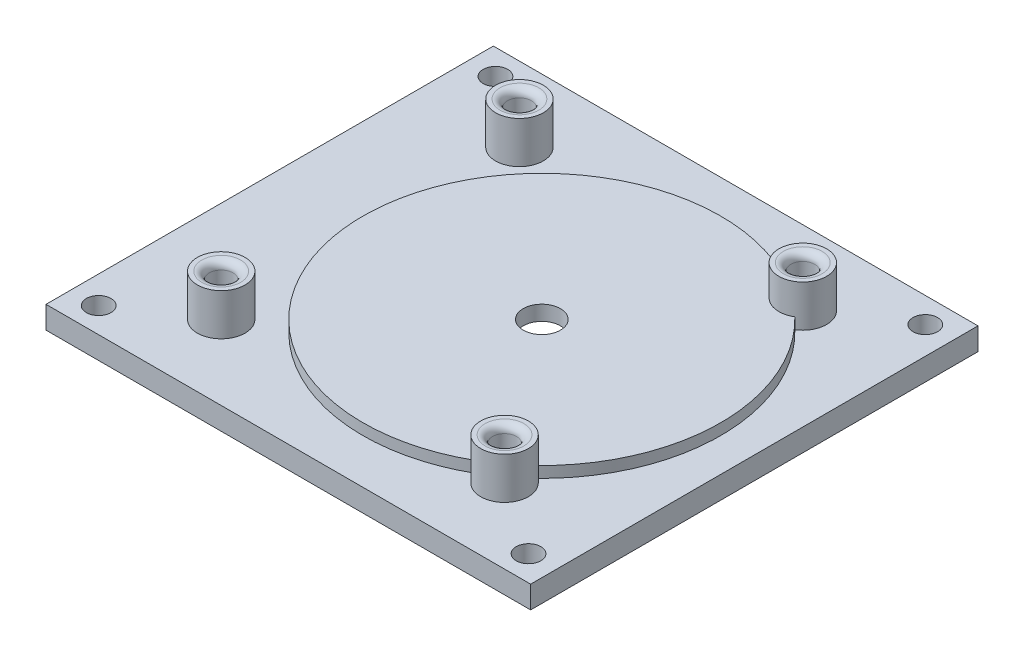
from build123d import *

# Parameters (mm, degrees)
SKETCH2_W           = 65
SKETCH2_H           = 60
SKETCH2_R           = 1.65
BOSS_EXTRUDE1_DEPTH = 3
SKETCH3_R           = 24
BOSS_EXTRUDE2_DEPTH = 1.5
SKETCH5_R           = 19
CUT_EXTRUDE1_DEPTH  = 2.5
SKETCH6_R           = 2.5
CUT_EXTRUDE2_DEPTH  = 89.573415876
SKETCH7_R           = 3.2
SKETCH7_R_2         = 1.6
BOSS_EXTRUDE3_DEPTH = 5.6
FILLET1_R           = 1


with BuildPart() as part:
    # Sketch2 → Boss-Extrude1 (new body)
    with BuildSketch(Plane(origin=(0, 0, 0), x_dir=(1, 0, 0), z_dir=(0, 1, 0))):
        with Locations((32.5, -30)):
            Rectangle(SKETCH2_W, SKETCH2_H)
        with Locations(Location((3.674017223, -3.391400514, 0), (0, 0, 270))):
            Circle(SKETCH2_R, mode=Mode.SUBTRACT)
        with Locations(Location((61.325982777, -3.391400514, 0), (0, 0, 270))):
            Circle(SKETCH2_R, mode=Mode.SUBTRACT)
        with Locations(Location((61.325982777, -56.608599486, 0), (0, 0, 270))):
            Circle(SKETCH2_R, mode=Mode.SUBTRACT)
        with Locations(Location((3.674017223, -56.608599486, 0), (0, 0, 270))):
            Circle(SKETCH2_R, mode=Mode.SUBTRACT)
    extrude(amount=BOSS_EXTRUDE1_DEPTH)

    # Sketch3 → Boss-Extrude2 (add)
    with BuildSketch(Plane(origin=(0, 3, 0), x_dir=(1, 0, 0), z_dir=(0, 1, 0))):
        with Locations(Location((36.5, -30, 0), (0, 0, 270))):
            Circle(SKETCH3_R)
    extrude(amount=BOSS_EXTRUDE2_DEPTH)

    # Sketch5 → Cut-Extrude1 (cut)
    with BuildSketch(Plane(origin=(0, 0, 0), x_dir=(1, 0, 0), z_dir=(0, 1, 0))):
        with Locations(Location((36.5, -30, 0), (0, 0, 270))):
            Circle(SKETCH5_R)
    extrude(amount=CUT_EXTRUDE1_DEPTH, mode=Mode.SUBTRACT)

    # Sketch6 → Cut-Extrude2 (cut, through all)
    with BuildSketch(Plane(origin=(0, 4.5, 0), x_dir=(1, 0, 0), z_dir=(0, 1, 0))):
        with Locations(Location((36.5, -30, 0), (0, 0, 270))):
            Circle(SKETCH6_R)
    extrude(amount=-CUT_EXTRUDE2_DEPTH, mode=Mode.SUBTRACT)

    # Sketch7 → Boss-Extrude3 (add)
    # profile 1 of 4: a face of its own
    with BuildSketch(Plane(origin=(0, 3, 0), x_dir=(1, 0, 0), z_dir=(0, 1, 0))):
        with Locations(Location((13.5, -10, 0), (0, 0, 270))):
            Circle(SKETCH7_R)
        with Locations(Location((13.5, -10, 0), (0, 0, 270))):
            Circle(SKETCH7_R_2, mode=Mode.SUBTRACT)
    # profile 2 of 4: a face of its own
    with BuildSketch(Plane(origin=(0, 3, 0), x_dir=(1, 0, 0), z_dir=(0, 1, 0))):
        with Locations(Location((13.5, -50, 0), (0, 0, 270))):
            Circle(SKETCH7_R)
        with Locations(Location((13.5, -50, 0), (0, 0, 270))):
            Circle(SKETCH7_R_2, mode=Mode.SUBTRACT)
    # profile 3 of 4: a face of its own
    with BuildSketch(Plane(origin=(0, 3, 0), x_dir=(1, 0, 0), z_dir=(0, 1, 0))):
        with Locations(Location((51.5, -10, 0), (0, 0, 164.861138608))):
            Circle(SKETCH7_R)
        with Locations(Location((51.5, -10, 0), (0, 0, 183.258299887))):
            Circle(SKETCH7_R_2, mode=Mode.SUBTRACT)
    # profile 4 of 4: a face of its own
    with BuildSketch(Plane(origin=(0, 3, 0), x_dir=(1, 0, 0), z_dir=(0, 1, 0))):
        with Locations(Location((51.5, -50, 0), (0, 0, 58.600933899))):
            Circle(SKETCH7_R)
        with Locations(Location((51.5, -50, 0), (0, 0, 76.998095179))):
            Circle(SKETCH7_R_2, mode=Mode.SUBTRACT)
    extrude(amount=BOSS_EXTRUDE3_DEPTH)

    # Fillet1
    fillet1_edges = [part.edges().sort_by_distance(p)[0] for p in [
        (13.5, 8.6, 48.4),
        (53.097413516, 8.6, 9.909060137),
        (51.140026484, 8.6, 51.558980137),
        (13.5, 8.6, 8.4),
    ]]
    fillet(fillet1_edges, radius=FILLET1_R)


solid = part.part
